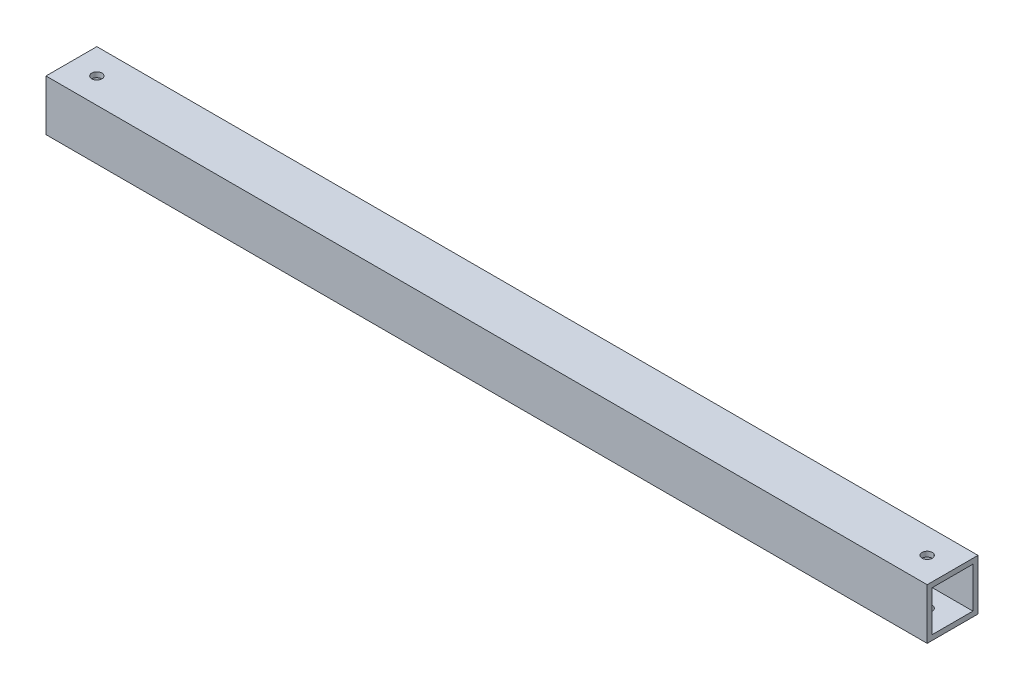
from build123d import *

# Parameters (mm, degrees)
SKETCH_2_W          = 260
SKETCH_2_H          = 15
EXTRUDE_1_DEPTH     = 15
SKETCH_3_R          = 1.5
CUT_EXTRUDE_1_DEPTH = 261.863949215
SKETCH_4_W          = 12
SKETCH_4_H          = 12
CUT_EXTRUDE_2_DEPTH = 261.863949215


with BuildPart() as part:
    # ｽｹｯﾁ2 → ﾎﾞｽ - 押し出し1 (new body)
    with BuildSketch(Plane.XY):
        with Locations((130, 7.5)):
            Rectangle(SKETCH_2_W, SKETCH_2_H)
    extrude(amount=EXTRUDE_1_DEPTH)

    # ｽｹｯﾁ3 → ｶｯﾄ - 押し出し1 (cut, through all)
    with BuildSketch(Plane(origin=(0, 15, 0), x_dir=(1, 0, 0), z_dir=(0, 1, 0))):
        with Locations(Location((7.5, -7.5, 0), (0, 0, 270))):
            Circle(SKETCH_3_R)
        with Locations(Location((252.5, -7.5, 0), (0, 0, 270))):
            Circle(SKETCH_3_R)
    extrude(amount=-CUT_EXTRUDE_1_DEPTH, mode=Mode.SUBTRACT)

    # ｽｹｯﾁ4 → ｶｯﾄ - 押し出し2 (cut, through all)
    with BuildSketch(Plane(origin=(260, 0, 0), x_dir=(0, 0, -1), z_dir=(1, 0, 0))):
        with Locations((-7.5, 7.5)):
            Rectangle(SKETCH_4_W, SKETCH_4_H)
    extrude(amount=-CUT_EXTRUDE_2_DEPTH, mode=Mode.SUBTRACT)


solid = part.part
